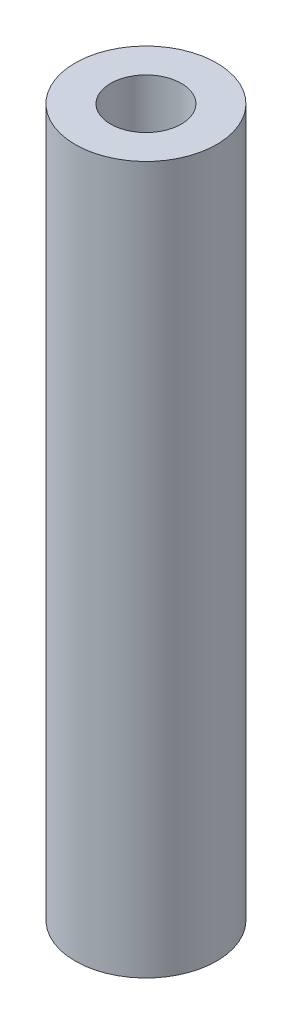
from build123d import *

# Parameters (mm, degrees)
SKETCH_1_R      = 2
SKETCH_1_R_2    = 1
EXTRUDE_1_DEPTH = 20


with BuildPart() as part:
    # 草图1 → 凸台-拉伸1 (new body)
    with BuildSketch(Plane(origin=(0, 0, 0), x_dir=(1, 0, 0), z_dir=(0, 1, 0))):
        with Locations(Location((0, 0, 0), (0, 0, 270))):
            Circle(SKETCH_1_R)
        with Locations(Location((0, 0, 0), (0, 0, 270))):
            Circle(SKETCH_1_R_2, mode=Mode.SUBTRACT)
    extrude(amount=EXTRUDE_1_DEPTH)


solid = part.part
